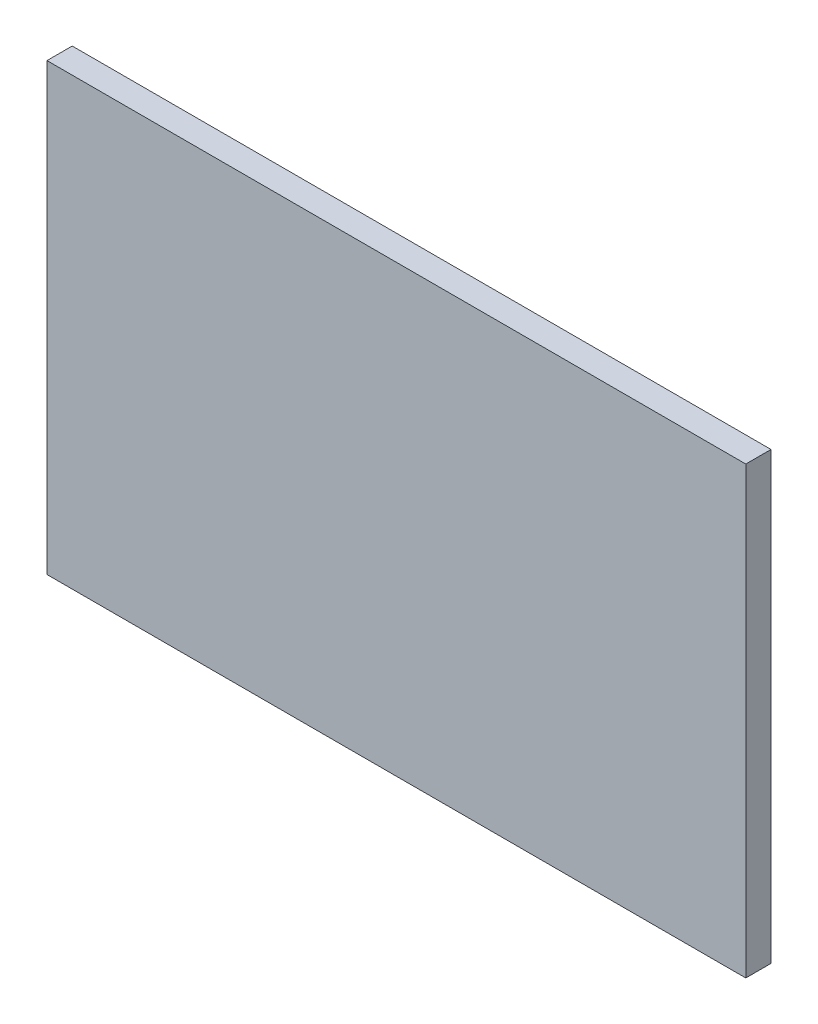
from build123d import *

# Parameters (mm, degrees)
SKETCH1_W           = 105.5116
SKETCH1_H           = 67.2084
BOSS_EXTRUDE1_DEPTH = 3.81


with BuildPart() as part:
    # Sketch1 → Boss-Extrude1 (new body)
    with BuildSketch(Plane.XY):
        Rectangle(SKETCH1_W, SKETCH1_H)
    extrude(amount=BOSS_EXTRUDE1_DEPTH)


solid = part.part
